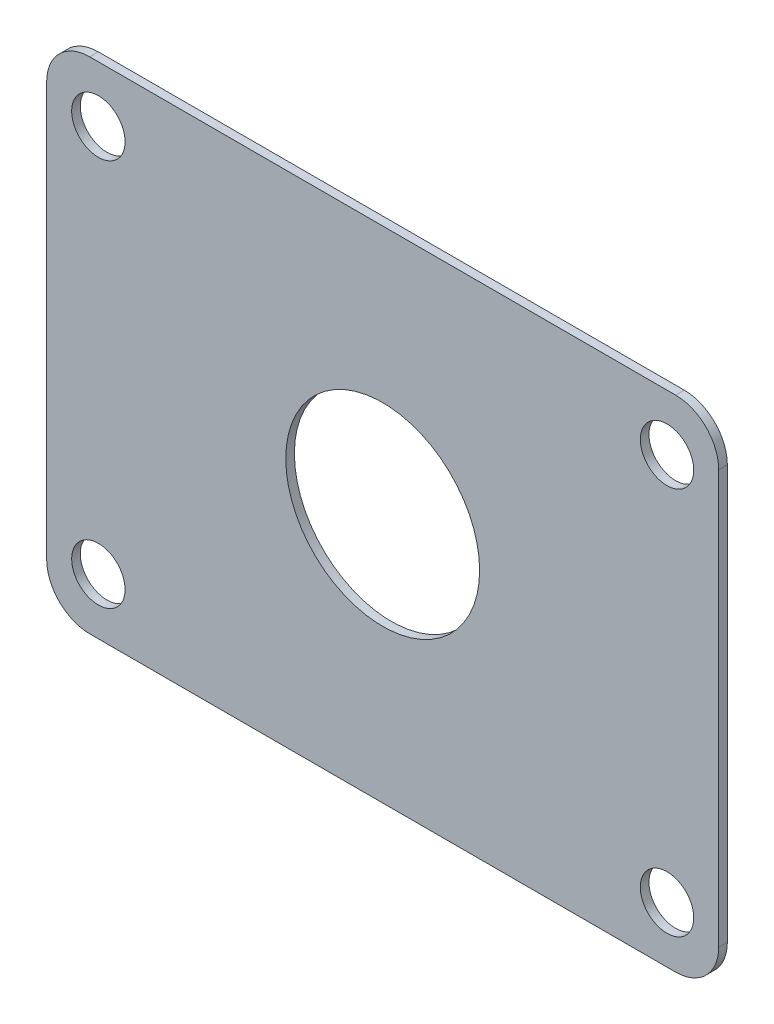
from build123d import *

# Parameters (mm, degrees)
SKETCH1_W           = 78
SKETCH1_H           = 58
BOSS_EXTRUDE1_DEPTH = 1
SKETCH2_R           = 3.1
SKETCH2_R_2         = 11.25
CUT_EXTRUDE1_DEPTH  = 10
FILLET1_R           = 5


with BuildPart() as part:
    # Sketch1 → Boss-Extrude1 (new body)
    with BuildSketch(Plane.XY):
        Rectangle(SKETCH1_W, SKETCH1_H)
    extrude(amount=BOSS_EXTRUDE1_DEPTH)

    # Sketch2 → Cut-Extrude1 (cut)
    with BuildSketch(Plane.XY.offset(1)):
        with Locations((-33, 22.5)):
            Circle(SKETCH2_R)
        with Locations(Location((33, 22.5, 0), (0, 0, 180))):
            Circle(SKETCH2_R)
        with Locations((33, -22.5)):
            Circle(SKETCH2_R)
        with Locations(Location((-33, -22.5, 0), (0, 0, 180))):
            Circle(SKETCH2_R)
        Circle(SKETCH2_R_2)
    extrude(amount=-CUT_EXTRUDE1_DEPTH, mode=Mode.SUBTRACT)

    # Fillet1
    fillet1_edges = [part.edges().sort_by_distance(p)[0] for p in [
        (-39, 29, 0.5),
        (39, 29, 0.5),
        (39, -29, 0.5),
        (-39, -29, 0.5),
    ]]
    fillet(fillet1_edges, radius=FILLET1_R)


solid = part.part
